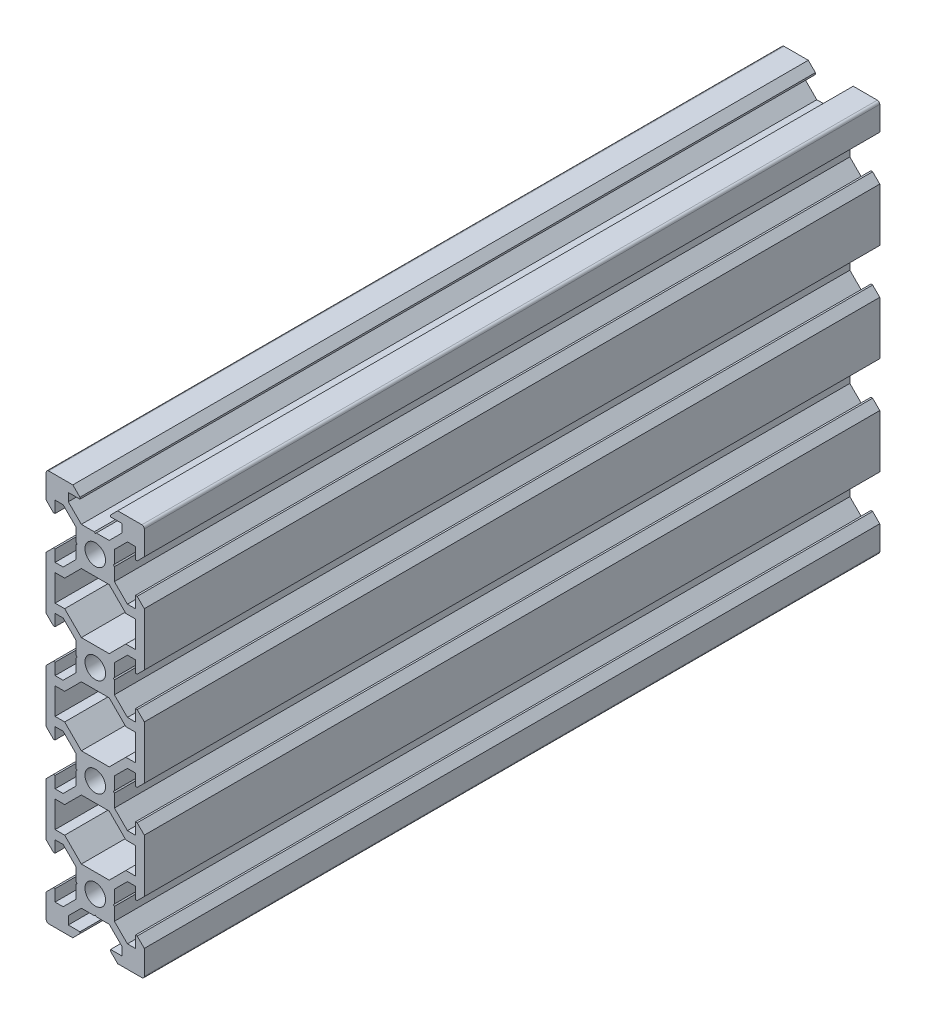
from build123d import *

# Parameters (mm, degrees)
SKETCH1_R           = 2.1
BOSS_EXTRUDE1_DEPTH = 150


with BuildPart() as part:
    # Sketch1 → Boss-Extrude1 (new body)
    with BuildSketch(Plane.XY.offset(500)):
        with BuildLine():
            Line((6.560660172, 24.5), (3.9, 27.160660172))
            Line((3.9, 27.160660172), (3.9, 29.79))
            Line((3.9, 29.79), (3.69, 30))
            Line((3.69, 30), (3.9, 30.21))
            Line((3.9, 30.21), (3.9, 32.839339828))
            Line((3.9, 32.839339828), (6.560660172, 35.5))
            Line((6.560660172, 35.5), (8.2, 35.5))
            Line((8.2, 35.5), (8.2, 33.125))
            Line((8.2, 33.125), (8.545, 33.125))
            Line((8.545, 33.125), (10, 34.58))
            Line((10, 34.58), (10, 39.5))
            ThreePointArc((10, 39.5), (9.853553391, 39.853553391), (9.5, 40))
            Line((9.5, 40), (4.58, 40))
            Line((4.58, 40), (3.125, 38.545))
            Line((3.125, 38.545), (3.125, 38.2))
            Line((3.125, 38.2), (5.5, 38.2))
            Line((5.5, 38.2), (5.5, 36.560660172))
            Line((5.5, 36.560660172), (2.839339828, 33.9))
            Line((2.839339828, 33.9), (0.21, 33.9))
            Line((0.21, 33.9), (0, 33.69))
            Line((0, 33.69), (-0.21, 33.9))
            Line((-0.21, 33.9), (-2.839339828, 33.9))
            Line((-2.839339828, 33.9), (-5.5, 36.560660172))
            Line((-5.5, 36.560660172), (-5.5, 38.2))
            Line((-5.5, 38.2), (-3.125, 38.2))
            Line((-3.125, 38.2), (-3.125, 38.545))
            Line((-3.125, 38.545), (-4.58, 40))
            Line((-4.58, 40), (-9.5, 40))
            ThreePointArc((-9.5, 40), (-9.853553391, 39.853553391), (-10, 39.5))
            Line((-10, 39.5), (-10, 34.58))
            Line((-10, 34.58), (-8.545, 33.125))
            Line((-8.545, 33.125), (-8.2, 33.125))
            Line((-8.2, 33.125), (-8.2, 35.5))
            Line((-8.2, 35.5), (-6.560660172, 35.5))
            Line((-6.560660172, 35.5), (-3.9, 32.839339828))
            Line((-3.9, 32.839339828), (-3.9, 30.21))
            Line((-3.9, 30.21), (-3.69, 30))
            Line((-3.69, 30), (-3.9, 29.79))
            Line((-3.9, 29.79), (-3.9, 27.160660172))
            Line((-3.9, 27.160660172), (-6.560660172, 24.5))
            Line((-6.560660172, 24.5), (-8.2, 24.5))
            Line((-8.2, 24.5), (-8.2, 26.875))
            Line((-8.2, 26.875), (-8.545, 26.875))
            Line((-8.545, 26.875), (-10, 25.42))
            Line((-10, 25.42), (-10, 14.58))
            Line((-10, 14.58), (-8.545, 13.125))
            Line((-8.545, 13.125), (-8.2, 13.125))
            Line((-8.2, 13.125), (-8.2, 15.5))
            Line((-8.2, 15.5), (-6.560660172, 15.5))
            Line((-6.560660172, 15.5), (-3.9, 12.839339828))
            Line((-3.9, 12.839339828), (-3.9, 10.21))
            Line((-3.9, 10.21), (-3.69, 10))
            Line((-3.69, 10), (-3.9, 9.79))
            Line((-3.9, 9.79), (-3.9, 7.160660172))
            Line((-3.9, 7.160660172), (-6.560660172, 4.5))
            Line((-6.560660172, 4.5), (-8.2, 4.5))
            Line((-8.2, 4.5), (-8.2, 6.875))
            Line((-8.2, 6.875), (-8.545, 6.875))
            Line((-8.545, 6.875), (-10, 5.42))
            Line((-10, 5.42), (-10, -5.42))
            Line((-10, -5.42), (-8.545, -6.875))
            Line((-8.545, -6.875), (-8.2, -6.875))
            Line((-8.2, -6.875), (-8.2, -4.5))
            Line((-8.2, -4.5), (-6.560660172, -4.5))
            Line((-6.560660172, -4.5), (-3.9, -7.160660172))
            Line((-3.9, -7.160660172), (-3.9, -9.79))
            Line((-3.9, -9.79), (-3.69, -10))
            Line((-3.69, -10), (-3.9, -10.21))
            Line((-3.9, -10.21), (-3.9, -12.839339828))
            Line((-3.9, -12.839339828), (-6.560660172, -15.5))
            Line((-6.560660172, -15.5), (-8.2, -15.5))
            Line((-8.2, -15.5), (-8.2, -13.125))
            Line((-8.2, -13.125), (-8.545, -13.125))
            Line((-8.545, -13.125), (-10, -14.58))
            Line((-10, -14.58), (-10, -25.42))
            Line((-10, -25.42), (-8.545, -26.875))
            Line((-8.545, -26.875), (-8.2, -26.875))
            Line((-8.2, -26.875), (-8.2, -24.5))
            Line((-8.2, -24.5), (-6.560660172, -24.5))
            Line((-6.560660172, -24.5), (-3.9, -27.160660172))
            Line((-3.9, -27.160660172), (-3.9, -29.79))
            Line((-3.9, -29.79), (-3.69, -30))
            Line((-3.69, -30), (-3.9, -30.21))
            Line((-3.9, -30.21), (-3.9, -32.839339828))
            Line((-3.9, -32.839339828), (-6.560660172, -35.5))
            Line((-6.560660172, -35.5), (-8.2, -35.5))
            Line((-8.2, -35.5), (-8.2, -33.125))
            Line((-8.2, -33.125), (-8.545, -33.125))
            Line((-8.545, -33.125), (-10, -34.58))
            Line((-10, -34.58), (-10, -39.5))
            ThreePointArc((-10, -39.5), (-9.853553391, -39.853553391), (-9.5, -40))
            Line((-9.5, -40), (-4.58, -40))
            Line((-4.58, -40), (-3.125, -38.545))
            Line((-3.125, -38.545), (-3.125, -38.2))
            Line((-3.125, -38.2), (-5.5, -38.2))
            Line((-5.5, -38.2), (-5.5, -36.560660172))
            Line((-5.5, -36.560660172), (-2.839339828, -33.9))
            Line((-2.839339828, -33.9), (-0.21, -33.9))
            Line((-0.21, -33.9), (0, -33.69))
            Line((0, -33.69), (0.21, -33.9))
            Line((0.21, -33.9), (2.839339828, -33.9))
            Line((2.839339828, -33.9), (5.5, -36.560660172))
            Line((5.5, -36.560660172), (5.5, -38.2))
            Line((5.5, -38.2), (3.125, -38.2))
            Line((3.125, -38.2), (3.125, -38.545))
            Line((3.125, -38.545), (4.58, -40))
            Line((4.58, -40), (9.5, -40))
            ThreePointArc((9.5, -40), (9.853553391, -39.853553391), (10, -39.5))
            Line((10, -39.5), (10, -34.58))
            Line((10, -34.58), (8.545, -33.125))
            Line((8.545, -33.125), (8.2, -33.125))
            Line((8.2, -33.125), (8.2, -35.5))
            Line((8.2, -35.5), (6.560660172, -35.5))
            Line((6.560660172, -35.5), (3.9, -32.839339828))
            Line((3.9, -32.839339828), (3.9, -30.21))
            Line((3.9, -30.21), (3.69, -30))
            Line((3.69, -30), (3.9, -29.79))
            Line((3.9, -29.79), (3.9, -27.160660172))
            Line((3.9, -27.160660172), (6.560660172, -24.5))
            Line((6.560660172, -24.5), (8.2, -24.5))
            Line((8.2, -24.5), (8.2, -26.875))
            Line((8.2, -26.875), (8.545, -26.875))
            Line((8.545, -26.875), (10, -25.42))
            Line((10, -25.42), (10, -14.58))
            Line((10, -14.58), (8.545, -13.125))
            Line((8.545, -13.125), (8.2, -13.125))
            Line((8.2, -13.125), (8.2, -15.5))
            Line((8.2, -15.5), (6.560660172, -15.5))
            Line((6.560660172, -15.5), (3.9, -12.839339828))
            Line((3.9, -12.839339828), (3.9, -10.21))
            Line((3.9, -10.21), (3.69, -10))
            Line((3.69, -10), (3.9, -9.79))
            Line((3.9, -9.79), (3.9, -7.160660172))
            Line((3.9, -7.160660172), (6.560660172, -4.5))
            Line((6.560660172, -4.5), (8.2, -4.5))
            Line((8.2, -4.5), (8.2, -6.875))
            Line((8.2, -6.875), (8.545, -6.875))
            Line((8.545, -6.875), (10, -5.42))
            Line((10, -5.42), (10, 5.42))
            Line((10, 5.42), (8.545, 6.875))
            Line((8.545, 6.875), (8.2, 6.875))
            Line((8.2, 6.875), (8.2, 4.5))
            Line((8.2, 4.5), (6.560660172, 4.5))
            Line((6.560660172, 4.5), (3.9, 7.160660172))
            Line((3.9, 7.160660172), (3.9, 9.79))
            Line((3.9, 9.79), (3.69, 10))
            Line((3.69, 10), (3.9, 10.21))
            Line((3.9, 10.21), (3.9, 12.839339828))
            Line((3.9, 12.839339828), (6.560660172, 15.5))
            Line((6.560660172, 15.5), (8.2, 15.5))
            Line((8.2, 15.5), (8.2, 13.125))
            Line((8.2, 13.125), (8.545, 13.125))
            Line((8.545, 13.125), (10, 14.58))
            Line((10, 14.58), (10, 25.42))
            Line((10, 25.42), (8.545, 26.875))
            Line((8.545, 26.875), (8.2, 26.875))
            Line((8.2, 26.875), (8.2, 24.5))
            Line((8.2, 24.5), (6.560660172, 24.5))
        make_face()
        with Locations(Location((0, -10, 0), (0, 0, 180))):
            Circle(SKETCH1_R, mode=Mode.SUBTRACT)
        with Locations(Location((0, 10, 0), (0, 0, 180))):
            Circle(SKETCH1_R, mode=Mode.SUBTRACT)
        with Locations(Location((0, 30, 0), (0, 0, 180))):
            Circle(SKETCH1_R, mode=Mode.SUBTRACT)
        with Locations(Location((0, -30, 0), (0, 0, 180))):
            Circle(SKETCH1_R, mode=Mode.SUBTRACT)
        Polygon((2.839339828, 13.9), (-2.839339828, 13.9), (-6.239339828, 17.3), (-8.2, 17.3), (-8.2, 22.7), (-6.239339828, 22.7), (-2.839339828, 26.1), (2.839339828, 26.1), (6.239339828, 22.7), (8.2, 22.7), (8.2, 17.3), (6.239339828, 17.3), align=None, mode=Mode.SUBTRACT)
        Polygon((2.839339828, -6.1), (-2.839339828, -6.1), (-6.239339828, -2.7), (-8.2, -2.7), (-8.2, 2.7), (-6.239339828, 2.7), (-2.839339828, 6.1), (2.839339828, 6.1), (6.239339828, 2.7), (8.2, 2.7), (8.2, -2.7), (6.239339828, -2.7), align=None, mode=Mode.SUBTRACT)
        Polygon((2.839339828, -26.1), (-2.839339828, -26.1), (-6.239339828, -22.7), (-8.2, -22.7), (-8.2, -17.3), (-6.239339828, -17.3), (-2.839339828, -13.9), (2.839339828, -13.9), (6.239339828, -17.3), (8.2, -17.3), (8.2, -22.7), (6.239339828, -22.7), align=None, mode=Mode.SUBTRACT)
    extrude(amount=-BOSS_EXTRUDE1_DEPTH)


solid = part.part
